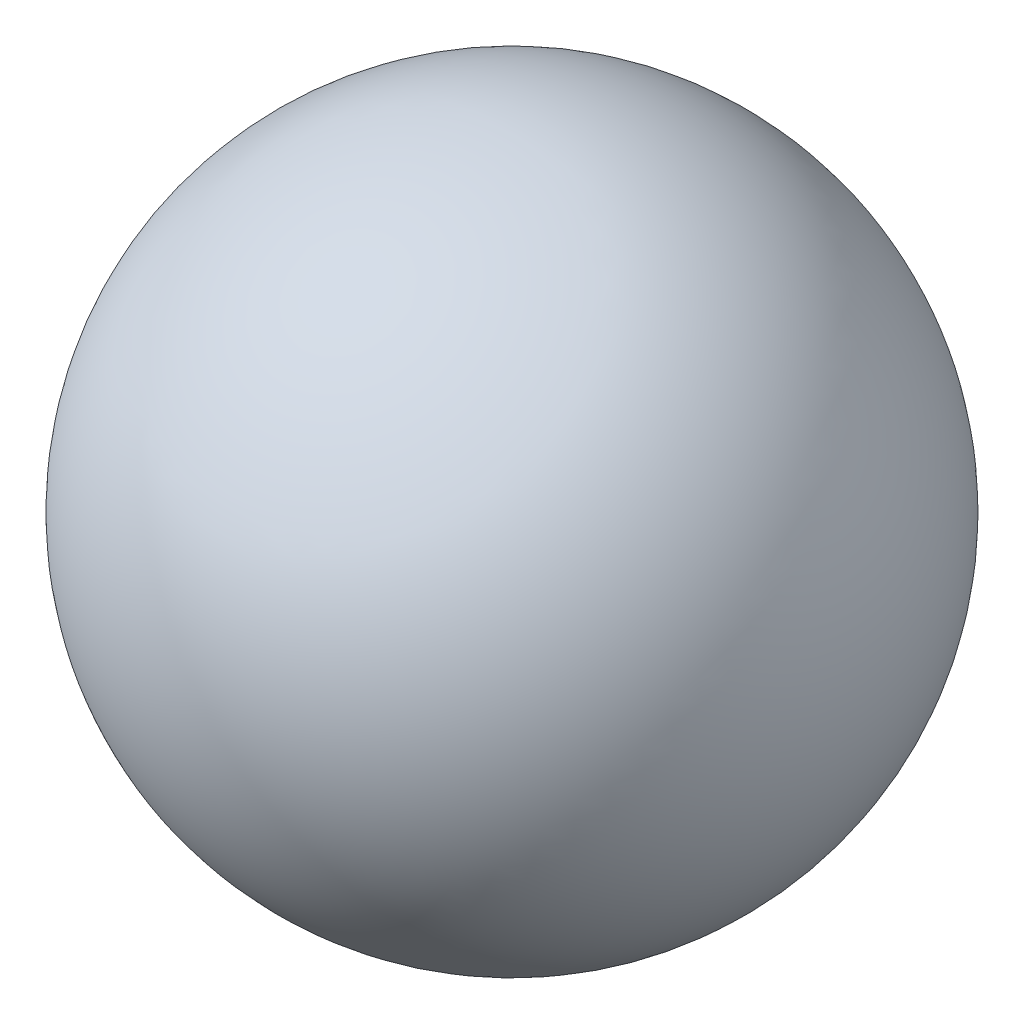
from build123d import *

# Parameters (mm, degrees)
SKETCH2_R          = 2
CUT_EXTRUDE1_DEPTH = 10
SKETCH3_W          = 12.97075966
SKETCH3_H          = 10.638477954
CUT_EXTRUDE2_DEPTH = 10


with BuildPart() as part:
    # Sketch1 → Revolve1 (revolve)
    with BuildSketch(Plane.XY):
        with BuildLine():
            Line((-5, 0), (5, 0))
            ThreePointArc((5, 0), (0, 5), (-5, 0))
        make_face()
    revolve(axis=Axis((-5, 0, 0), (1, 0, 0)))

    # Sketch2 → Cut-Extrude1 (cut)
    with BuildSketch(Plane.XY):
        Circle(SKETCH2_R)
    extrude(amount=-CUT_EXTRUDE1_DEPTH, mode=Mode.SUBTRACT)

    # Sketch3 → Cut-Extrude2 (cut)
    with BuildSketch(Plane.XY.offset(-4.2)):
        Rectangle(SKETCH3_W, SKETCH3_H)
    extrude(amount=-CUT_EXTRUDE2_DEPTH, mode=Mode.SUBTRACT)


solid = part.part
